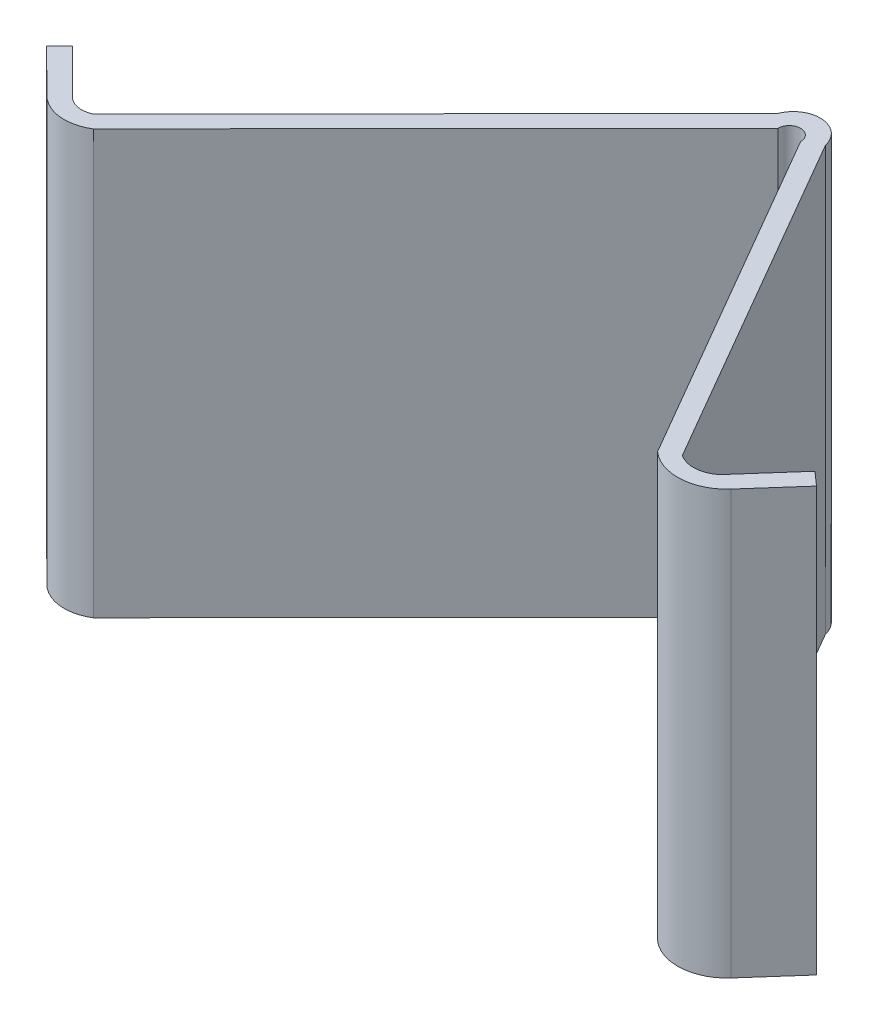
from build123d import *

# Parameters (mm, degrees)
EXTRUDE_1_DEPTH = 70


with BuildPart() as part:
    # 草圖1 → 填料-伸長1 (new body)
    with BuildSketch(Plane(origin=(0, 0, 0), x_dir=(1, 0, 0), z_dir=(0, 1, 0))):
        with BuildLine():
            Line((10.996587269, 18.037741282), (-45.487838574, -38.61479297))
            ThreePointArc((-45.487838574, -38.61479297), (-47.84934361, -38.895811815), (-49.888582931, -37.672218494))
            Line((-49.888582931, -37.672218494), (-56.970149713, -30.611665263))
            Line((-56.970149713, -30.611665263), (-59.088315682, -32.736135298))
            Line((-59.088315682, -32.736135298), (-52.0067489, -39.796688528))
            ThreePointArc((-52.0067489, -39.796688528), (-47.849605549, -41.783872953), (-43.363368539, -40.732958939))
            Line((-43.363368539, -40.732958939), (13.121057303, 15.919575313))
            ThreePointArc((13.121057303, 15.919575313), (15.009846467, 17.808364477), (16.898635631, 15.919575313))
            Line((16.898635631, 15.919575313), (49.482242531, -40.323722611))
            ThreePointArc((49.482242531, -40.323722611), (55.349857539, -42.316518092), (60.91576552, -39.592402078))
            Line((60.91576552, -39.592402078), (67.542344378, -32.103179645))
            Line((67.542344378, -32.103179645), (65.295577648, -30.115205988))
            Line((65.295577648, -30.115205988), (58.66899879, -37.60442842))
            ThreePointArc((58.66899879, -37.60442842), (55.618475046, -39.540333545), (52.078087051, -38.819863831))
            Line((52.078087051, -38.819863831), (19.494480151, 17.423434093))
            ThreePointArc((19.494480151, 17.423434093), (15.47366289, 20.886366054), (10.996587269, 18.037741282))
        make_face()
    extrude(amount=EXTRUDE_1_DEPTH)


solid = part.part
